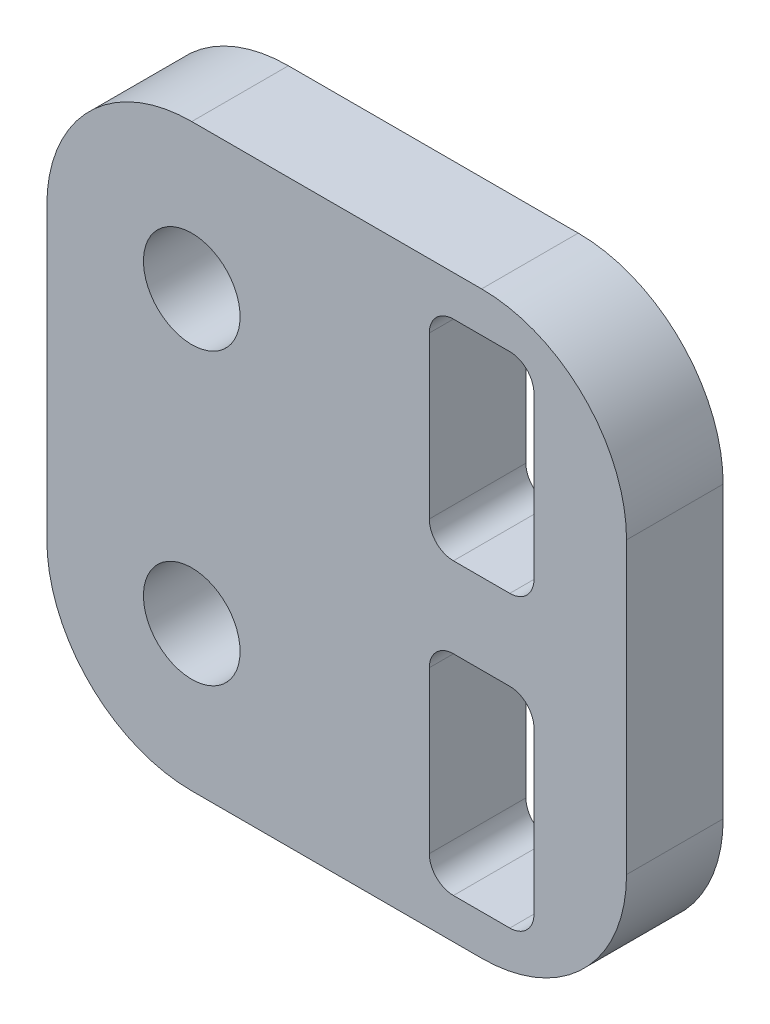
from build123d import *

# Parameters (mm, degrees)
MODEL_R                 = 1.5
SALIENTE_EXTRUIR1_DEPTH = 3


with BuildPart() as part:
    # Model → Saliente-Extruir1 (new body)
    with BuildSketch(Plane.XY):
        with BuildLine():
            Line((195.335922194, 161.333196305), (204.335922194, 161.333196305))
            ThreePointArc((204.335922194, 161.333196305), (207.517902709, 162.651215789), (208.835922194, 165.833196305))
            Line((208.835922194, 165.833196305), (208.835922194, 174.833196305))
            ThreePointArc((208.835922194, 174.833196305), (207.517902709, 178.01517682), (204.335922194, 179.333196305))
            Line((204.335922194, 179.333196305), (195.335922194, 179.333196305))
            ThreePointArc((195.335922194, 179.333196305), (192.153941678, 178.01517682), (190.835922194, 174.833196305))
            Line((190.835922194, 174.833196305), (190.835922194, 165.833196305))
            ThreePointArc((190.835922194, 165.833196305), (192.153941678, 162.651215789), (195.335922194, 161.333196305))
        make_face()
        with Locations((195.335922194, 174.833196305)):
            Circle(MODEL_R, mode=Mode.SUBTRACT)
        with Locations((195.335922194, 165.833196305)):
            Circle(MODEL_R, mode=Mode.SUBTRACT)
        with BuildLine():
            Line((202.710922194, 172.333196305), (202.710922194, 177.333196305))
            ThreePointArc((202.710922194, 177.333196305), (202.930592108, 177.86352639), (203.460922194, 178.083196305))
            Line((203.460922194, 178.083196305), (205.210922194, 178.083196305))
            ThreePointArc((205.210922194, 178.083196305), (205.74125228, 177.86352639), (205.960922194, 177.333196305))
            Line((205.960922194, 177.333196305), (205.960922194, 172.333196305))
            ThreePointArc((205.960922194, 172.333196305), (205.74125228, 171.802866219), (205.210922194, 171.583196305))
            Line((205.210922194, 171.583196305), (203.460922194, 171.583196305))
            ThreePointArc((203.460922194, 171.583196305), (202.930592108, 171.802866219), (202.710922194, 172.333196305))
        make_face(mode=Mode.SUBTRACT)
        with BuildLine():
            Line((205.960922194, 168.333196305), (205.960922194, 163.333196305))
            ThreePointArc((205.960922194, 163.333196305), (205.74125228, 162.802866219), (205.210922194, 162.583196305))
            Line((205.210922194, 162.583196305), (203.460922194, 162.583196305))
            ThreePointArc((203.460922194, 162.583196305), (202.930592108, 162.802866219), (202.710922194, 163.333196305))
            Line((202.710922194, 163.333196305), (202.710922194, 168.333196305))
            ThreePointArc((202.710922194, 168.333196305), (202.930592108, 168.86352639), (203.460922194, 169.083196305))
            Line((203.460922194, 169.083196305), (205.210922194, 169.083196305))
            ThreePointArc((205.210922194, 169.083196305), (205.74125228, 168.86352639), (205.960922194, 168.333196305))
        make_face(mode=Mode.SUBTRACT)
    extrude(amount=SALIENTE_EXTRUIR1_DEPTH)


solid = part.part
